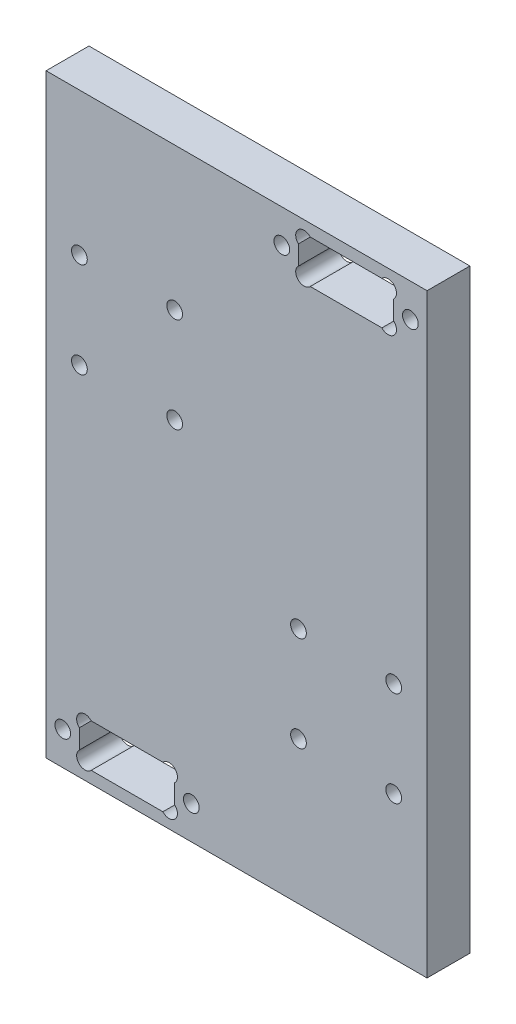
from build123d import *

# Parameters (mm, degrees)
ESQUISSE1_W                  = 80
ESQUISSE1_H                  = 125
BOSS_EXTRU_1_DEPTH           = 9
ESQUISSE2_W                  = 20
ESQUISSE2_H                  = 9
ENL_V_MAT_EXTRU_1_DEPTH      = 9
ENL_V_MAT_EXTRU_2_DEPTH      = 149.680866287
ENL_V_MAT_EXTRU_2_DEPTH_BACK = 149.680866287
ESQUISSE3_R                  = 1.65
ESQUISSE4_R                  = 1.65
ENL_V_MAT_EXTRU_3_DEPTH      = 9


with BuildPart() as part:
    # Esquisse1 → Boss.-Extru.1 (new body)
    with BuildSketch(Plane.XY):
        with Locations((40, 62.5)):
            Rectangle(ESQUISSE1_W, ESQUISSE1_H)
    extrude(amount=BOSS_EXTRU_1_DEPTH)

    # Esquisse2 → Enlèv. mat.-Extru.1 (cut)
    with BuildSketch(Plane.XY.offset(9)):
        with Locations((17, 7)):
            Rectangle(ESQUISSE2_W, ESQUISSE2_H)
        with Locations((63, 118)):
            Rectangle(ESQUISSE2_W, ESQUISSE2_H)
    extrude(amount=-ENL_V_MAT_EXTRU_1_DEPTH, mode=Mode.SUBTRACT)

    # Esquisse3 → Enlèv. mat.-Extru.2 (cut, two sides: drawn at the far end of the back side and taken through both)
    with BuildSketch(Plane.XY.offset(9).offset(-ENL_V_MAT_EXTRU_2_DEPTH_BACK)):
        with Locations((3.5, 7)):
            Circle(ESQUISSE3_R)
        with Locations(Location((30.5, 7, 0), (0, 0, 180))):
            Circle(ESQUISSE3_R)
        with Locations(Location((49.5, 118, 0), (0, 0, 180))):
            Circle(ESQUISSE3_R)
        with Locations((76.5, 118)):
            Circle(ESQUISSE3_R)
        with BuildLine():
            Line((7, 9.025126266), (9.474873734, 11.5))
            ThreePointArc((9.474873734, 11.5), (6.929289322, 11.570710678), (7, 9.025126266))
        make_face()
        with BuildLine():
            Line((27, 9.025126266), (24.525126266, 11.5))
            ThreePointArc((24.525126266, 11.5), (27.070710678, 11.570710678), (27, 9.025126266))
        make_face()
        with BuildLine():
            Line((27, 4.974873734), (24.525126266, 2.5))
            ThreePointArc((24.525126266, 2.5), (27.070710678, 2.429289322), (27, 4.974873734))
        make_face()
        with BuildLine():
            Line((7, 4.974873734), (9.474873734, 2.5))
            ThreePointArc((9.474873734, 2.5), (6.929289322, 2.429289322), (7, 4.974873734))
        make_face()
        with BuildLine():
            Line((73, 115.974873734), (70.525126266, 113.5))
            ThreePointArc((70.525126266, 113.5), (73.070710678, 113.429289322), (73, 115.974873734))
        make_face()
        with BuildLine():
            Line((53, 115.974873734), (55.474873734, 113.5))
            ThreePointArc((55.474873734, 113.5), (52.929289322, 113.429289322), (53, 115.974873734))
        make_face()
        with BuildLine():
            Line((53, 120.025126266), (55.474873734, 122.5))
            ThreePointArc((55.474873734, 122.5), (52.929289322, 122.570710678), (53, 120.025126266))
        make_face()
        with BuildLine():
            Line((73, 120.025126266), (70.525126266, 122.5))
            ThreePointArc((70.525126266, 122.5), (73.070710678, 122.570710678), (73, 120.025126266))
        make_face()
    extrude(amount=ENL_V_MAT_EXTRU_2_DEPTH + ENL_V_MAT_EXTRU_2_DEPTH_BACK, mode=Mode.SUBTRACT)

    # Esquisse4 → Enlèv. mat.-Extru.3 (cut)
    with BuildSketch(Plane.XY.offset(9)):
        with Locations((7, 95)):
            Circle(ESQUISSE4_R)
        with Locations(Location((27, 95, 0), (0, 0, 180))):
            Circle(ESQUISSE4_R)
        with Locations((27, 75)):
            Circle(ESQUISSE4_R)
        with Locations(Location((7, 75, 0), (0, 0, 180))):
            Circle(ESQUISSE4_R)
        with Locations((73, 30)):
            Circle(ESQUISSE4_R)
        with Locations(Location((53, 30, 0), (0, 0, 180))):
            Circle(ESQUISSE4_R)
        with Locations((53, 50)):
            Circle(ESQUISSE4_R)
        with Locations(Location((73, 50, 0), (0, 0, 180))):
            Circle(ESQUISSE4_R)
    extrude(amount=-ENL_V_MAT_EXTRU_3_DEPTH, mode=Mode.SUBTRACT)


solid = part.part
